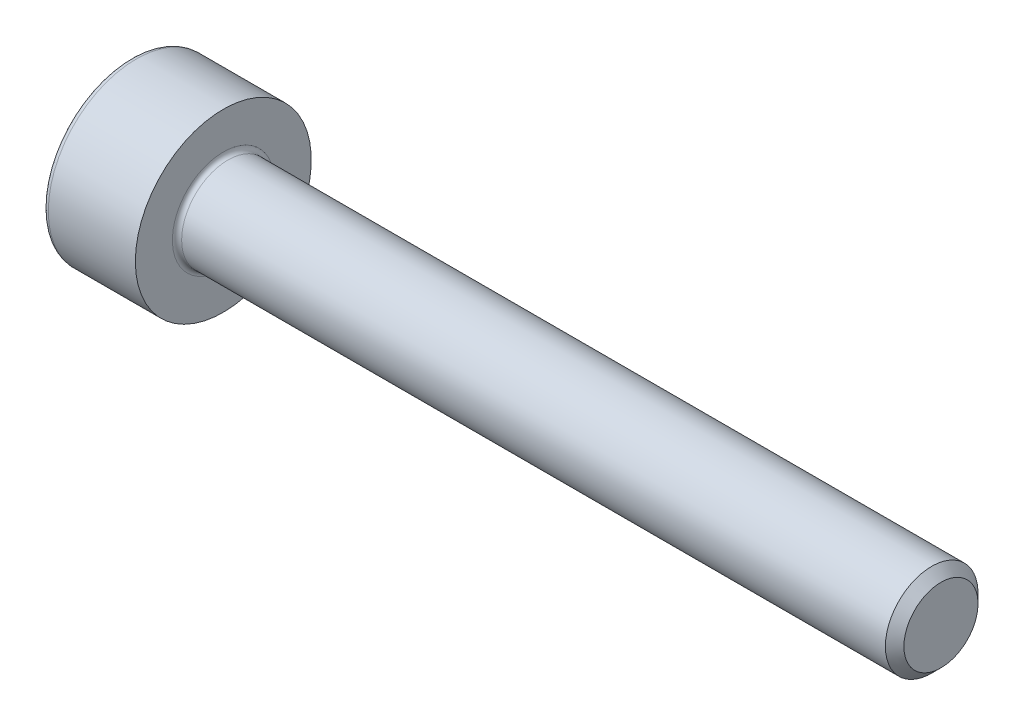
from build123d import *

# Parameters (mm, degrees)
FILLET1_R      = 0.1
FILLET2_R      = 0.12
CHAMFER1_SIZE  = 0.2
EXTRUDE1_DEPTH = 1


with BuildPart() as part:
    # Sketch1 → Revolve1 (revolve)
    with BuildSketch(Plane.XY, mode=Mode.PRIVATE) as revolve1_sk:
        Polygon((2, 1), (2, 0), (4.279914881, 0), (17.5, 0), (17.5, 1), align=None)
        Polygon((0, 1.9), (0, 0), (2, 0), (2, 1), (2, 1.9), align=None)
    revolve(revolve1_sk.sketch.rotate(Axis((0, 0, 0), (1, 0, 0)), 90), axis=Axis((0, 0, 0), (1, 0, 0)))

    # Fillet1
    fillet1_edges = [part.edges().sort_by_distance(p)[0] for p in [
        (2, 0, -1),
    ]]
    fillet(fillet1_edges, radius=FILLET1_R)

    # Fillet2
    fillet2_edges = [part.edges().sort_by_distance(p)[0] for p in [
        (0, 0, -1.9),
    ]]
    fillet(fillet2_edges, radius=FILLET2_R)

    # Chamfer1
    chamfer1_edges = [part.edges().sort_by_distance(p)[0] for p in [
        (17.5, 0, -1),
    ]]
    chamfer(chamfer1_edges, length=CHAMFER1_SIZE)

    # Sketch2 → Extrude1 (cut)
    with BuildSketch(Plane.ZY):
        Polygon((0, 0.866025404), (-0.75, 0.433012702), (-0.75, -0.433012702), (0, -0.866025404), (0.75, -0.433012702), (0.75, 0.433012702), align=None)
    extrude(amount=-EXTRUDE1_DEPTH, mode=Mode.SUBTRACT)


solid = part.part
